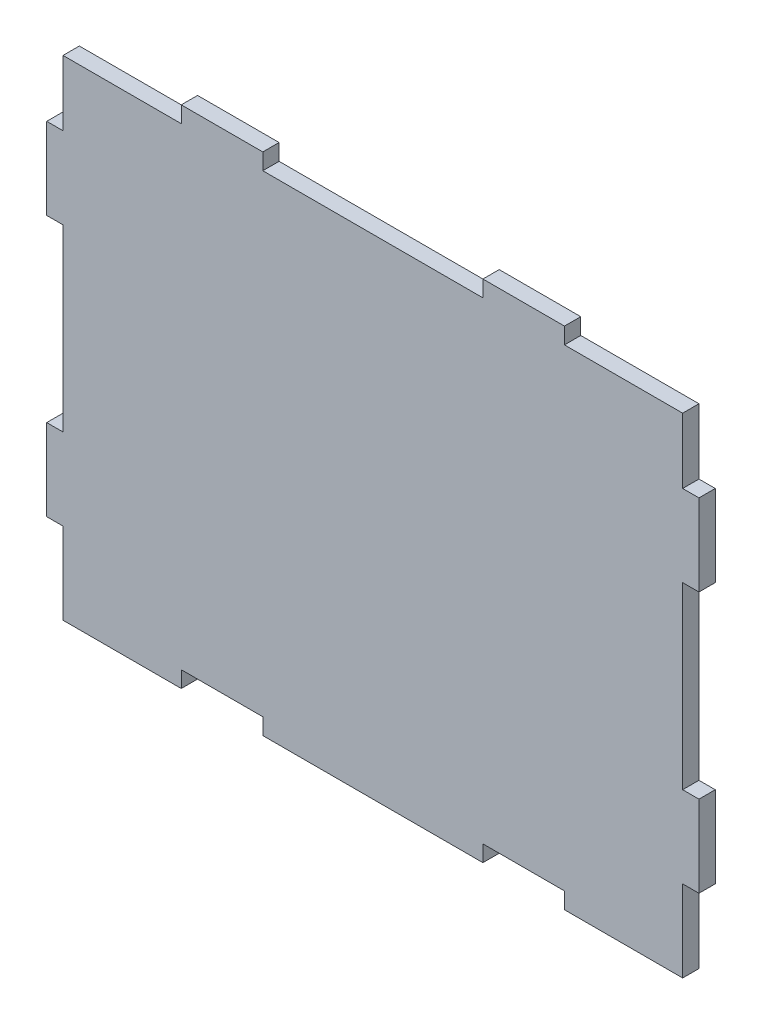
from build123d import *

# Parameters (mm, degrees)
SKETCH1_W           = 36.83
SKETCH1_H           = 5.08
SKETCH1_W_2         = 25.4
BOSS_EXTRUDE1_DEPTH = 5.08
SKETCH2_W           = 5.08
SKETCH2_H           = 25.4
BOSS_EXTRUDE2_DEPTH = 5.08


with BuildPart() as part:
    # Sketch1 → Boss-Extrude1 (new body)
    with BuildSketch(Plane.XY):
        Polygon((59.69, -83.82), (96.52, -83.82), (96.52, 63.5), (59.69, 63.5), (34.29, 63.5), (-34.29, 63.5), (-59.69, 63.5), (-96.52, 63.5), (-96.52, -83.82), (-59.69, -83.82), (-34.29, -83.82), (-34.29, -88.9), (34.29, -88.9), (34.29, -83.82), align=None)
        with Locations((78.105, -86.36)):
            Rectangle(SKETCH1_W, SKETCH1_H)
        with Locations((-78.105, -86.36)):
            Rectangle(SKETCH1_W, SKETCH1_H)
        with Locations((46.99, 66.04)):
            Rectangle(SKETCH1_W_2, SKETCH1_H)
        with Locations((-46.99, 66.04)):
            Rectangle(SKETCH1_W_2, SKETCH1_H)
    extrude(amount=BOSS_EXTRUDE1_DEPTH)

    # Sketch2 → Boss-Extrude2 (add)
    with BuildSketch(Plane.XY.offset(5.08)):
        with Locations((99.06, -50.8)):
            Rectangle(SKETCH2_W, SKETCH2_H)
        with Locations((99.06, 30.48)):
            Rectangle(SKETCH2_W, SKETCH2_H)
        with Locations((-99.06, -50.8)):
            Rectangle(SKETCH2_W, SKETCH2_H)
        with Locations((-99.06, 30.48)):
            Rectangle(SKETCH2_W, SKETCH2_H)
    extrude(amount=-BOSS_EXTRUDE2_DEPTH)


solid = part.part
